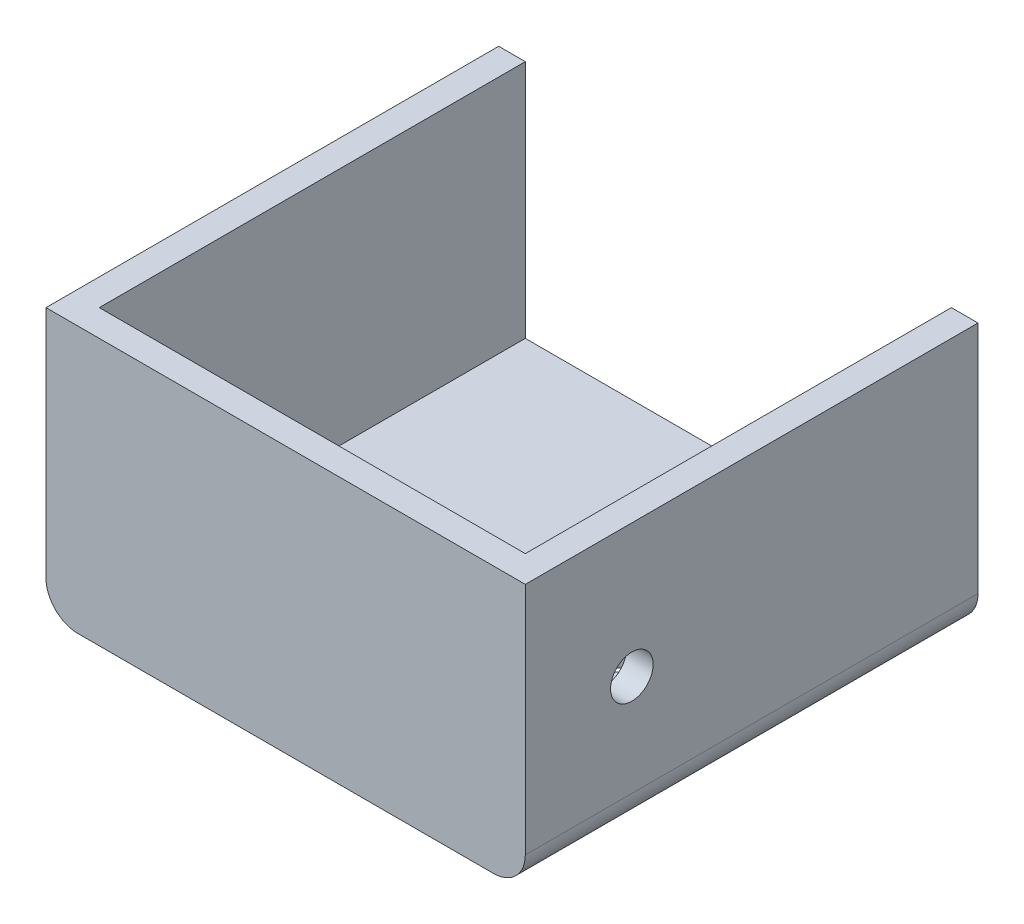
from build123d import *

# Parameters (mm, degrees)
CROQUIS1_W              = 45
CROQUIS1_H              = 25
SALIENTE_EXTRUIR1_DEPTH = 2.5
SALIENTE_EXTRUIR2_DEPTH = 40
REDONDEO2_R             = 3
REDONDEO3_R             = 3
CROQUIS3_R              = 2
CORTAR_EXTRUIR1_DEPTH   = 100
CROQUIS4_R              = 2
CORTAR_EXTRUIR2_DEPTH   = 40


with BuildPart() as part:
    # Croquis1 → Saliente-Extruir1 (new body)
    with BuildSketch(Plane.XY):
        Rectangle(CROQUIS1_W, CROQUIS1_H)
    extrude(amount=-SALIENTE_EXTRUIR1_DEPTH)

    # Croquis2 → Saliente-Extruir2 (add)
    with BuildSketch(Plane(origin=(0, 0, -2.5), x_dir=(-1, 0, 0), z_dir=(0, 0, -1))):
        Polygon((-22.5, 12.5), (-20, 12.5), (-20, -10), (20, -10), (20, 12.5), (22.5, 12.5), (22.5, -12.5), (20, -12.5), (-20, -12.5), (-22.5, -12.5), align=None)
    extrude(amount=SALIENTE_EXTRUIR2_DEPTH)

    # Redondeo2
    redondeo2_edges = [part.edges().sort_by_distance(p)[0] for p in [
        (22.5, -12.5, -21.25),
    ]]
    fillet(redondeo2_edges, radius=REDONDEO2_R)

    # Redondeo3
    redondeo3_edges = [part.edges().sort_by_distance(p)[0] for p in [
        (-22.5, -12.5, -21.25),
    ]]
    fillet(redondeo3_edges, radius=REDONDEO3_R)

    # Croquis3 → Cortar-Extruir1 (cut)
    with BuildSketch(Plane(origin=(22.5, 0, 0), x_dir=(0, 0, -1), z_dir=(1, 0, 0))):
        with Locations((10, 0)):
            Circle(CROQUIS3_R)
    extrude(amount=-CORTAR_EXTRUIR1_DEPTH, mode=Mode.SUBTRACT)

    # Croquis4 → Cortar-Extruir2 (cut)
    with BuildSketch(Plane.XZ.offset(12.5)):
        with Locations(Location((-10, -21.1, 0), (0, 0, 270))):
            Circle(CROQUIS4_R)
        with Locations(Location((10, -21.1, 0), (0, 0, 270))):
            Circle(CROQUIS4_R)
    extrude(amount=-CORTAR_EXTRUIR2_DEPTH, mode=Mode.SUBTRACT)


solid = part.part
